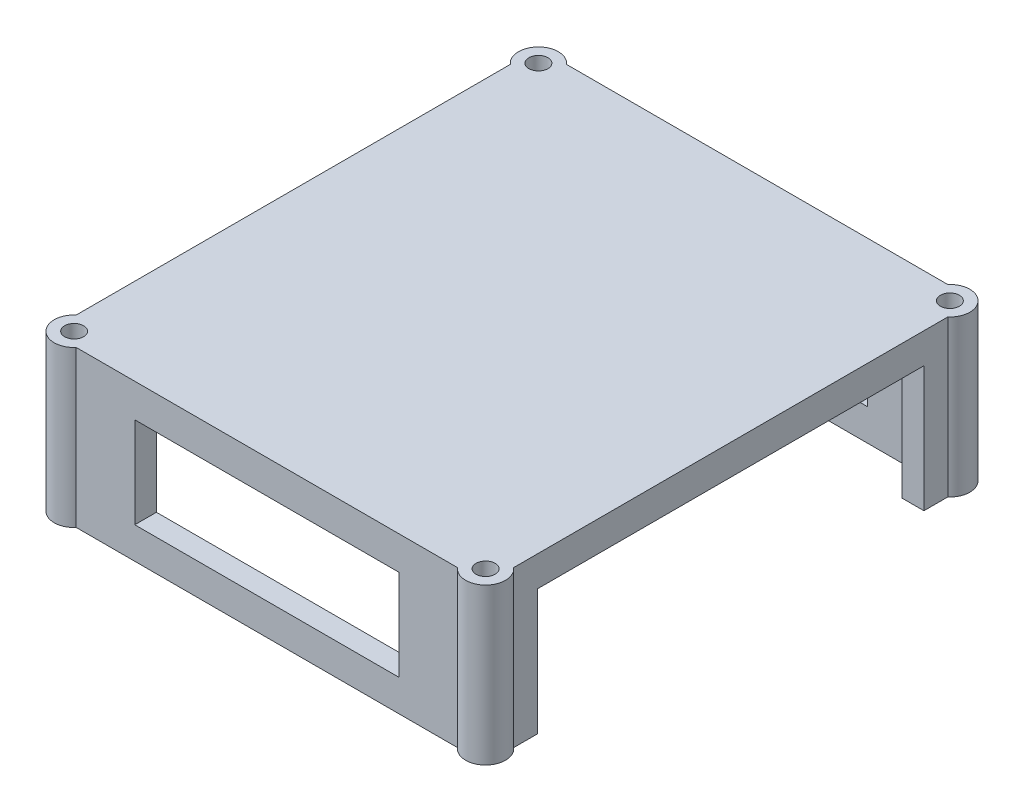
from build123d import *

# Parameters (mm, degrees)
SKETCH1_W           = 128.27
SKETCH1_H           = 143.764
BOSS_EXTRUDE1_DEPTH = 45.72
SKETCH3_W           = 115.57
SKETCH3_H           = 131.064
CUT_EXTRUDE1_DEPTH  = 41.91
SKETCH4_W           = 77.47
SKETCH4_H           = 26.67
CUT_EXTRUDE2_DEPTH  = 190.754
SKETCH5_W           = 113.284
SKETCH5_H           = 46.99
CUT_EXTRUDE3_DEPTH  = 190.754
SKETCH6_R           = 2.794
CUT_EXTRUDE4_DEPTH  = 199.019188454
SKETCH7_R           = 5.842
SKETCH7_R_2         = 2.794
BOSS_EXTRUDE2_DEPTH = 45.72
BOSS_EXTRUDE3_START = -45.72
SKETCH8_R           = 5.842
SKETCH8_R_2         = 2.794
BOSS_EXTRUDE3_DEPTH = 45.72
SKETCH9_R           = 5.842
SKETCH9_R_2         = 2.794
BOSS_EXTRUDE4_DEPTH = 45.72
BOSS_EXTRUDE5_START = -45.72
SKETCH10_R          = 5.842
SKETCH10_R_2        = 2.794
BOSS_EXTRUDE5_DEPTH = 45.72


with BuildPart() as part:
    # Sketch1 → Boss-Extrude1 (new body)
    with BuildSketch(Plane(origin=(0, 0, 0), x_dir=(1, 0, 0), z_dir=(0, 1, 0))):
        with Locations((64.135, 71.882)):
            Rectangle(SKETCH1_W, SKETCH1_H)
    extrude(amount=BOSS_EXTRUDE1_DEPTH)

    # Sketch3 → Cut-Extrude1 (cut)
    with BuildSketch(Plane.XZ):
        with Locations((64.135, -71.882)):
            Rectangle(SKETCH3_W, SKETCH3_H)
    extrude(amount=-CUT_EXTRUDE1_DEPTH, mode=Mode.SUBTRACT)

    # Sketch4 → Cut-Extrude2 (cut)
    with BuildSketch(Plane(origin=(0, 0, -143.764), x_dir=(-1, 0, 0), z_dir=(0, 0, -1))):
        with Locations((-64.135, 22.606)):
            Rectangle(SKETCH4_W, SKETCH4_H)
    extrude(amount=-CUT_EXTRUDE2_DEPTH, mode=Mode.SUBTRACT)

    # Sketch5 → Cut-Extrude3 (cut)
    with BuildSketch(Plane(origin=(128.27, 0, 0), x_dir=(0, 0, -1), z_dir=(1, 0, 0))):
        with Locations((71.882, 13.335)):
            Rectangle(SKETCH5_W, SKETCH5_H)
    extrude(amount=-CUT_EXTRUDE3_DEPTH, mode=Mode.SUBTRACT)

    # Sketch6 → Cut-Extrude4 (cut, through all)
    with BuildSketch(Plane(origin=(0, 0, 0), x_dir=(-1, 0, 0), z_dir=(0, -1, 0))):
        with Locations(Location((-3.81, 3.81, 0), (0, 0, 90))):
            Circle(SKETCH6_R)
        with Locations(Location((-124.46, 3.81, 0), (0, 0, 90))):
            Circle(SKETCH6_R)
        with Locations(Location((-3.81, 139.954, 0), (0, 0, 90))):
            Circle(SKETCH6_R)
        with Locations(Location((-124.46, 139.954, 0), (0, 0, 90))):
            Circle(SKETCH6_R)
    extrude(amount=-CUT_EXTRUDE4_DEPTH, mode=Mode.SUBTRACT)

    # Sketch7 → Boss-Extrude2 (add, through all)
    with BuildSketch(Plane.XZ):
        with Locations((3.81, -3.81)):
            Circle(SKETCH7_R)
        with Locations(Location((3.81, -3.81, 0), (0, 0, 270))):
            Circle(SKETCH7_R_2, mode=Mode.SUBTRACT)
    extrude(amount=-BOSS_EXTRUDE2_DEPTH)

    # Sketch8 → Boss-Extrude3 (add)
    with BuildSketch(Plane.XZ.offset(BOSS_EXTRUDE3_START)):
        with Locations((124.46, -3.81)):
            Circle(SKETCH8_R)
        with Locations(Location((124.46, -3.81, 0), (0, 0, 270))):
            Circle(SKETCH8_R_2, mode=Mode.SUBTRACT)
    extrude(amount=BOSS_EXTRUDE3_DEPTH)

    # Sketch9 → Boss-Extrude4 (add, through all)
    with BuildSketch(Plane.XZ):
        with Locations((3.81, -139.954)):
            Circle(SKETCH9_R)
        with Locations(Location((3.81, -139.954, 0), (0, 0, 270))):
            Circle(SKETCH9_R_2, mode=Mode.SUBTRACT)
    extrude(amount=-BOSS_EXTRUDE4_DEPTH)

    # Sketch10 → Boss-Extrude5 (add)
    with BuildSketch(Plane.XZ.offset(BOSS_EXTRUDE5_START)):
        with Locations((124.46, -139.954)):
            Circle(SKETCH10_R)
        with Locations(Location((124.46, -139.954, 0), (0, 0, 270))):
            Circle(SKETCH10_R_2, mode=Mode.SUBTRACT)
    extrude(amount=BOSS_EXTRUDE5_DEPTH)


solid = part.part
